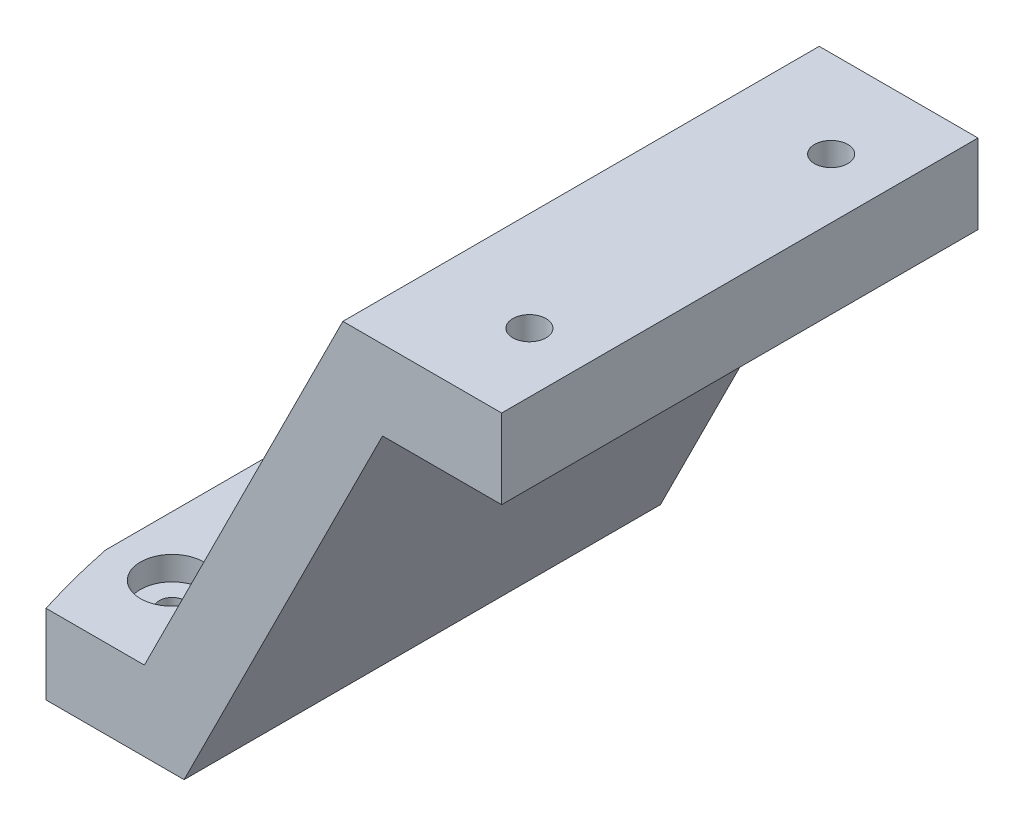
from build123d import *

# Parameters (mm, degrees)
EXTRUDE_1_DEPTH     = 60
SKETCH_2_R          = 171.976759521
SKETCH_2_R_2        = 100
CUT_EXTRUDE_1_DEPTH = 60
SKETCH_3_W          = 40
SKETCH_3_H          = 40
CUT_EXTRUDE_2_DEPTH = 5
FILLET_1_R          = 5
SKETCH_4_R          = 1.6
CUT_EXTRUDE_3_DEPTH = 10
SKETCH_5_R          = 4
CUT_EXTRUDE_4_DEPTH = 3
SKETCH_6_R          = 2.1
CUT_EXTRUDE_5_DEPTH = 88.749643874
SKETCH_7_W          = 7.2
SKETCH_7_H          = 7.2
CUT_EXTRUDE_6_DEPTH = 3


with BuildPart() as part:
    # 草图1 → 凸台-拉伸1 (new body)
    with BuildSketch(Plane.XY):
        Polygon((0, 0), (-20, 0), (-20, 10), (-5, 10), (20, 60), (40, 60), (40, 50), (25, 50), align=None)
    extrude(amount=EXTRUDE_1_DEPTH)

    # 草图2 → 切除-拉伸1 (cut)
    with BuildSketch(Plane(origin=(0, 10, 0), x_dir=(1, 0, 0), z_dir=(0, 1, 0))):
        with Locations((78, -30)):
            Circle(SKETCH_2_R)
        with Locations((78, -30)):
            Circle(SKETCH_2_R_2, mode=Mode.SUBTRACT)
    extrude(amount=-CUT_EXTRUDE_1_DEPTH, mode=Mode.SUBTRACT)

    # 草图3 → 切除-拉伸2 (cut)
    with BuildSketch(Plane(origin=(-8, 4, 0), x_dir=(0, 0, 1), z_dir=(-0.894427190999916, 0.4472135954999579, 0))):
        with Locations((30, 34.659053651)):
            Rectangle(SKETCH_3_W, SKETCH_3_H)
    extrude(amount=-CUT_EXTRUDE_2_DEPTH, mode=Mode.SUBTRACT)

    # 圆角1
    fillet_1_edges = [part.edges().sort_by_distance(p)[0] for p in [
        (18.680339887, 51.770509831, 50),
        (0.791796068, 15.993422191, 50),
        (0.791796068, 15.993422191, 10),
        (18.680339887, 51.770509831, 10),
    ]]
    fillet(fillet_1_edges, radius=FILLET_1_R)

    # 草图4 → 切除-拉伸3 (cut)
    with BuildSketch(Plane(origin=(0, 10, 0), x_dir=(1, 0, 0), z_dir=(0, 1, 0))):
        with Locations(Location((-12.5, -49, 0), (0, 0, 270))):
            Circle(SKETCH_4_R)
        with Locations(Location((-12.5, -11, 0), (0, 0, 270))):
            Circle(SKETCH_4_R)
    extrude(amount=-CUT_EXTRUDE_3_DEPTH, mode=Mode.SUBTRACT)

    # 草图5 → 切除-拉伸4 (cut)
    with BuildSketch(Plane(origin=(0, 10, 0), x_dir=(1, 0, 0), z_dir=(0, 1, 0))):
        with Locations(Location((-12.5, -49, 0), (0, 0, 270))):
            Circle(SKETCH_5_R)
        with Locations(Location((-12.5, -11, 0), (0, 0, 270))):
            Circle(SKETCH_5_R)
    extrude(amount=-CUT_EXTRUDE_4_DEPTH, mode=Mode.SUBTRACT)

    # 草图6 → 切除-拉伸5 (cut, through all)
    with BuildSketch(Plane.XZ.offset(-50)):
        with Locations(Location((32.5, 11, 0), (0, 0, 270))):
            Circle(SKETCH_6_R)
        with Locations(Location((32.5, 49, 0), (0, 0, 270))):
            Circle(SKETCH_6_R)
    extrude(amount=-CUT_EXTRUDE_5_DEPTH, mode=Mode.SUBTRACT)

    # 草图7 → 切除-拉伸6 (cut)
    with BuildSketch(Plane.XZ.offset(-50)):
        with Locations((32.5, 11)):
            Rectangle(SKETCH_7_W, SKETCH_7_H)
        with Locations((32.5, 49)):
            Rectangle(SKETCH_7_W, SKETCH_7_H)
    extrude(amount=-CUT_EXTRUDE_6_DEPTH, mode=Mode.SUBTRACT)


solid = part.part
